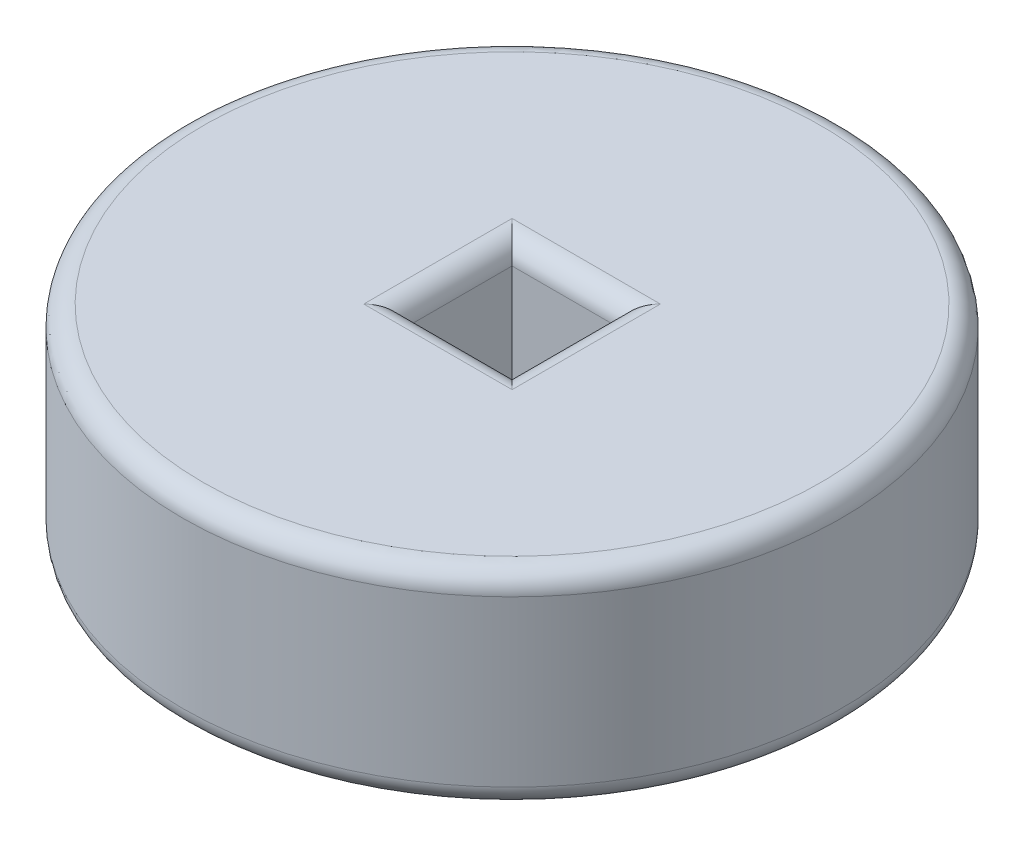
from build123d import *

# Parameters (mm, degrees)
SKETCH1_R           = 20.32
SKETCH1_W           = 6.604
SKETCH1_H           = 6.604
BOSS_EXTRUDE1_DEPTH = 12.7
FILLET1_R           = 1.27


with BuildPart() as part:
    # Sketch1 → Boss-Extrude1 (new body)
    with BuildSketch(Plane(origin=(0, 0, 0), x_dir=(1, 0, 0), z_dir=(0, 1, 0))):
        with Locations(Location((0, 0, 0), (0, 0, 270))):
            Circle(SKETCH1_R)
        Rectangle(SKETCH1_W, SKETCH1_H, mode=Mode.SUBTRACT)
    extrude(amount=BOSS_EXTRUDE1_DEPTH)

    # Fillet1
    fillet1_edges = [part.edges().sort_by_distance(p)[0] for p in [
        (-3.302, 12.7, 0),
        (0, 12.7, 3.302),
        (0, 0, -20.32),
        (0, 12.7, -20.32),
        (3.302, 0, 0),
        (0, 0, -3.302),
        (-3.302, 0, 0),
        (0, 0, 3.302),
        (3.302, 12.7, 0),
        (0, 12.7, -3.302),
    ]]
    fillet(fillet1_edges, radius=FILLET1_R)


solid = part.part
